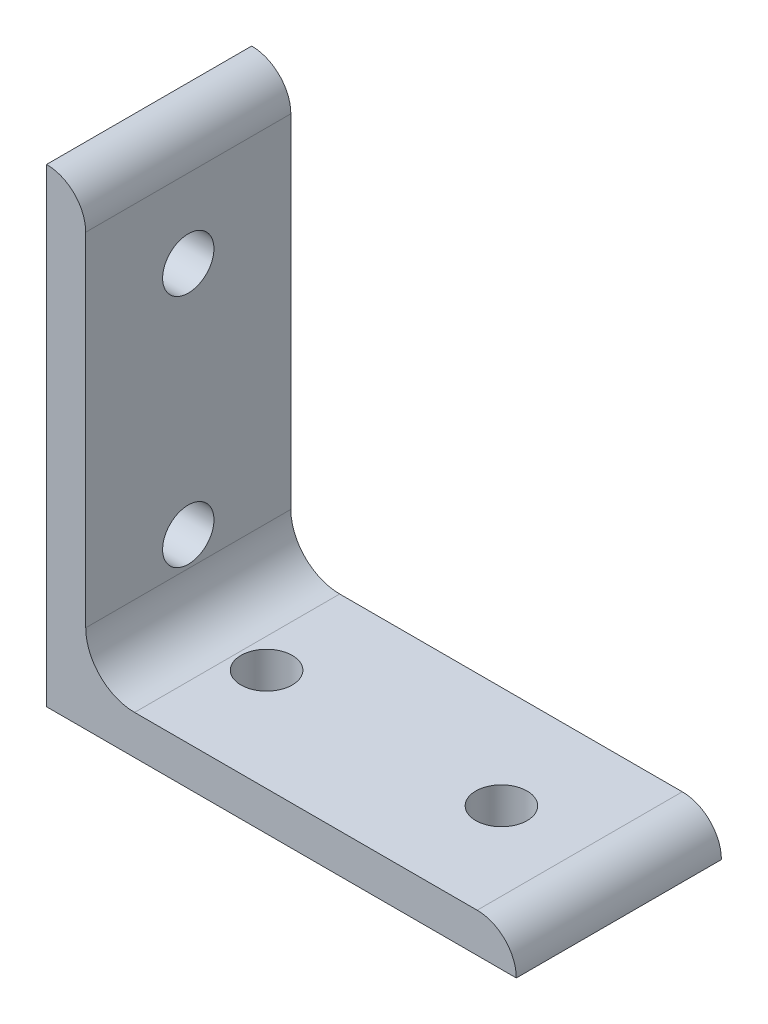
from build123d import *

# Parameters (mm, degrees)
BOSS_EXTRUDE1_DEPTH = 16.637
SKETCH2_R           = 4.1656
CUT_EXTRUDE1_DEPTH  = 110.03976233
SKETCH3_R           = 4.1656
CUT_EXTRUDE2_DEPTH  = 110.03976233


with BuildPart() as part:
    # Sketch1 → Boss-Extrude1 (new, symmetric)
    with BuildSketch(Plane.XY):
        with BuildLine():
            Line((0, 0), (0, 76.2))
            ThreePointArc((0, 76.2), (4.490128061, 74.340128061), (6.35, 69.85))
            Line((6.35, 69.85), (6.35, 14.2748))
            ThreePointArc((6.35, 14.2748), (8.67112018, 8.67112018), (14.2748, 6.35))
            Line((14.2748, 6.35), (69.85, 6.35))
            ThreePointArc((69.85, 6.35), (74.340128061, 4.490128061), (76.2, 0))
            Line((76.2, 0), (0, 0))
        make_face()
    extrude(amount=BOSS_EXTRUDE1_DEPTH, both=True)

    # Sketch2 → Cut-Extrude1 (cut, through all)
    with BuildSketch(Plane(origin=(0, 0, 0), x_dir=(1, 0, 0), z_dir=(0, 1, 0))):
        with Locations(Location((19.05, 0, 0), (0, 0, 90))):
            Circle(SKETCH2_R)
        with Locations(Location((57.15, 0, 0), (0, 0, 90))):
            Circle(SKETCH2_R)
    extrude(amount=CUT_EXTRUDE1_DEPTH, mode=Mode.SUBTRACT)

    # Sketch3 → Cut-Extrude2 (cut, through all)
    with BuildSketch(Plane(origin=(0, 0, 0), x_dir=(0, 0, -1), z_dir=(1, 0, 0))):
        with Locations(Location((0, 19.05, 0), (0, 0, 270))):
            Circle(SKETCH3_R)
        with Locations(Location((0, 57.15, 0), (0, 0, 270))):
            Circle(SKETCH3_R)
    extrude(amount=CUT_EXTRUDE2_DEPTH, mode=Mode.SUBTRACT)


solid = part.part
